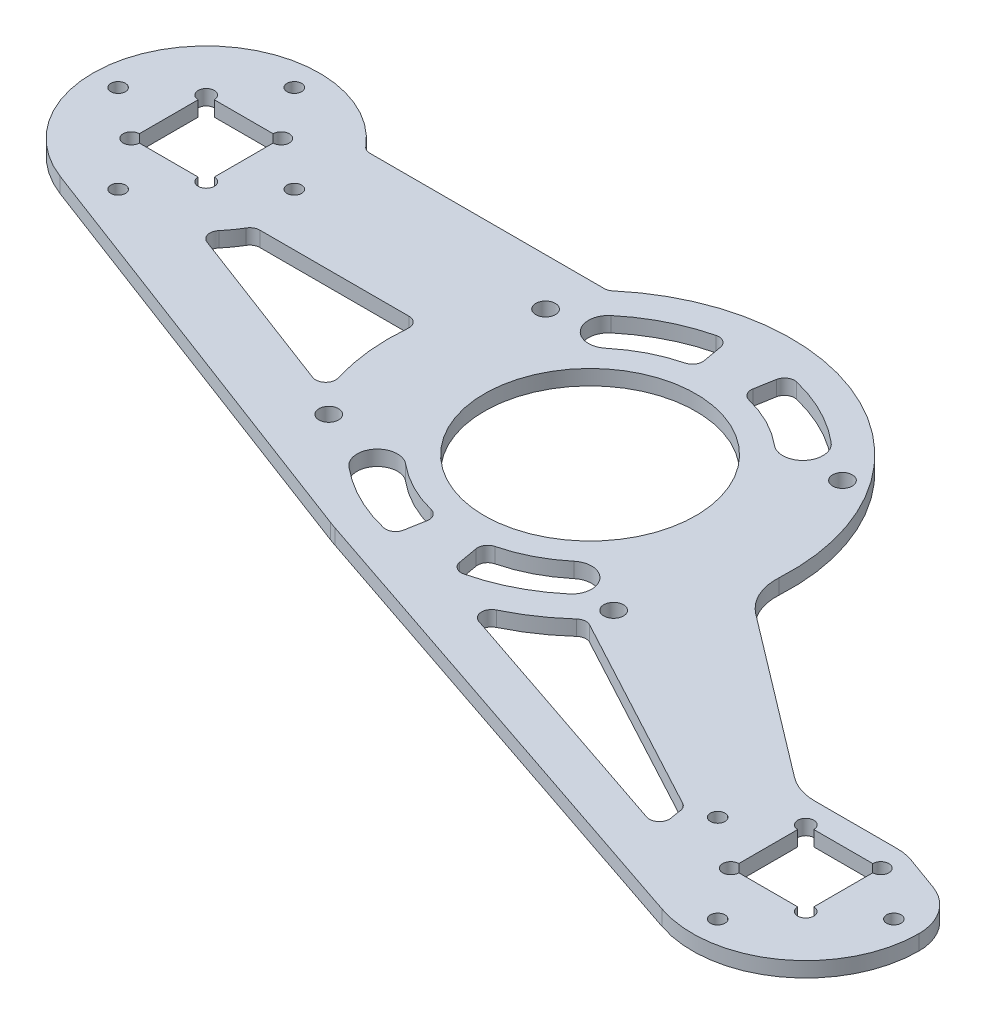
from build123d import *

# Parameters (mm, degrees)
SKETCH_1_W           = 206
SKETCH_1_H           = 60
SKETCH_1_R           = 21
EXTRUDE_1_DEPTH      = 3
SKETCH_2_W           = 14.9
SKETCH_2_H           = 14.9
CUT_EXTRUDE_1_DEPTH  = 108.321945566
SKETCH_3_W           = 80
SKETCH_3_H           = 35.85
CUT_EXTRUDE_2_DEPTH  = 108.321945566
SKETCH_4_R           = 22.5
SKETCH_4_W           = 14.9
SKETCH_4_H           = 14.9
EXTRUDE_2_DEPTH      = 3
EXTRUDE_START        = -3
SKETCH_5_R           = 40
SKETCH_5_R_2         = 21
EXTRUDE_3_DEPTH      = 3
SKETCH_6_R           = 1.6
CUT_EXTRUDE_3_DEPTH  = 122.842121206
SKETCH_7_R           = 1.45
CUT_EXTRUDE_4_DEPTH  = 122.842121206
SKETCH_8_R           = 5
EXTRUDE_4_DEPTH      = 3
SKETCH_9_R           = 1.95
CUT_EXTRUDE_5_DEPTH  = 122.842121206
SKETCH_10_R          = 1.95
CUT_EXTRUDE_6_DEPTH  = 122.842121206
EXTRUDE_5_DEPTH      = 3
FILLET_1_R           = 2
CUT_EXTRUDE_7_DEPTH  = 122.842121206
EXTRUDE_6_DEPTH      = 3
FILLET_2_R           = 2
SKETCH_14_R          = 22.5
SKETCH_14_R_2        = 1.45
SKETCH_14_W          = 14.9
SKETCH_14_H          = 14.9
EXTRUDE_7_DEPTH      = 3
CUT_EXTRUDE_8_DEPTH  = 136.861482768
EXTRUDE_8_DEPTH      = 3
CUT_EXTRUDE_9_DEPTH  = 136.861482768
EXTRUDE_9_DEPTH      = 3
EXTRUDE_10_DEPTH     = 3
FILLET_3_R           = 2
FILLET_4_R           = 10
SKETCH_21_R          = 1.6
CUT_EXTRUDE_10_DEPTH = 136.861482768


with BuildPart() as part:
    # 草图1 → 凸台-拉伸1 (new body)
    with BuildSketch(Plane(origin=(0, 0, 0), x_dir=(1, 0, 0), z_dir=(0, 1, 0))):
        Rectangle(SKETCH_1_W, SKETCH_1_H)
        with Locations(Location((0, 0, 0), (0, 0, 270))):
            Circle(SKETCH_1_R, mode=Mode.SUBTRACT)
    extrude(amount=EXTRUDE_1_DEPTH)

    # 草图2 → 切除-拉伸1 (cut, through all)
    with BuildSketch(Plane(origin=(0, 3, 0), x_dir=(1, 0, 0), z_dir=(0, 1, 0))):
        with Locations((-92.55, 16.3)):
            Rectangle(SKETCH_2_W, SKETCH_2_H)
        with Locations((92.55, 16.3)):
            Rectangle(SKETCH_2_W, SKETCH_2_H)
    extrude(amount=-CUT_EXTRUDE_1_DEPTH, mode=Mode.SUBTRACT)

    # 草图3 → 切除-拉伸2 (cut, through all)
    with BuildSketch(Plane(origin=(0, 3, 0), x_dir=(1, 0, 0), z_dir=(0, 1, 0))):
        with Locations((-63, -12.075)):
            Rectangle(SKETCH_3_W, SKETCH_3_H)
        with Locations((63, -12.075)):
            Rectangle(SKETCH_3_W, SKETCH_3_H)
    extrude(amount=-CUT_EXTRUDE_2_DEPTH, mode=Mode.SUBTRACT)

    # 草图4 → 凸台-拉伸2 (add)
    # profile 1 of 2: a face of its own
    with BuildSketch(Plane(origin=(0, 3, 0), x_dir=(1, 0, 0), z_dir=(0, 1, 0))):
        with Locations((-92.55, 16.3)):
            Circle(SKETCH_4_R)
        with Locations((-92.55, 16.3)):
            Rectangle(SKETCH_4_W, SKETCH_4_H, mode=Mode.SUBTRACT)
    # profile 2 of 2: a face of its own
    with BuildSketch(Plane(origin=(0, 3, 0), x_dir=(1, 0, 0), z_dir=(0, 1, 0))):
        with Locations((92.55, 16.3)):
            Circle(SKETCH_4_R)
        with Locations((92.55, 16.3)):
            Rectangle(SKETCH_4_W, SKETCH_4_H, mode=Mode.SUBTRACT)
    extrude(amount=-EXTRUDE_2_DEPTH)

    # 草图5 → 凸台-拉伸3 (add)
    with BuildSketch(Plane(origin=(0, 3, 0), x_dir=(1, 0, 0), z_dir=(0, 1, 0)).offset(EXTRUDE_START)):
        Circle(SKETCH_5_R)
        with Locations(Location((0, 0, 0), (0, 0, 270))):
            Circle(SKETCH_5_R_2, mode=Mode.SUBTRACT)
    extrude(amount=EXTRUDE_3_DEPTH)

    # 草图6 → 切除-拉伸3 (cut, through all)
    with BuildSketch(Plane(origin=(0, 3, 0), x_dir=(1, 0, 0), z_dir=(0, 1, 0))):
        with Locations((-100, 23.75)):
            Circle(SKETCH_6_R)
        with Locations((-85.1, 23.75)):
            Circle(SKETCH_6_R)
        with Locations((-100, 8.85)):
            Circle(SKETCH_6_R)
        with Locations((-85.1, 8.85)):
            Circle(SKETCH_6_R)
        with Locations((85.1, 8.85)):
            Circle(SKETCH_6_R)
        with Locations((100, 8.85)):
            Circle(SKETCH_6_R)
        with Locations((85.1, 23.75)):
            Circle(SKETCH_6_R)
        with Locations((100, 23.75)):
            Circle(SKETCH_6_R)
    extrude(amount=-CUT_EXTRUDE_3_DEPTH, mode=Mode.SUBTRACT)

    # 草图7 → 切除-拉伸4 (cut, through all)
    with BuildSketch(Plane(origin=(0, 3, 0), x_dir=(1, 0, 0), z_dir=(0, 1, 0))):
        with Locations(Location((-92.55, 33.8, 0), (0, 0, 270))):
            Circle(SKETCH_7_R)
        with Locations(Location((-75.05, 16.3, 0), (0, 0, 270))):
            Circle(SKETCH_7_R)
        with Locations(Location((-92.55, -1.2, 0), (0, 0, 270))):
            Circle(SKETCH_7_R)
        with Locations(Location((-110.05, 16.3, 0), (0, 0, 270))):
            Circle(SKETCH_7_R)
        with Locations(Location((110.05, 16.3, 0), (0, 0, 90))):
            Circle(SKETCH_7_R)
        with Locations(Location((92.55, -1.2, 0), (0, 0, 90))):
            Circle(SKETCH_7_R)
        with Locations(Location((75.05, 16.3, 0), (0, 0, 90))):
            Circle(SKETCH_7_R)
        with Locations(Location((92.55, 33.8, 0), (0, 0, 90))):
            Circle(SKETCH_7_R)
    extrude(amount=-CUT_EXTRUDE_4_DEPTH, mode=Mode.SUBTRACT)

    # 草图8 → 凸台-拉伸4 (add)
    with BuildSketch(Plane(origin=(0, 3, 0), x_dir=(1, 0, 0), z_dir=(0, 1, 0))):
        with Locations((-32.908965344, -19)):
            Circle(SKETCH_8_R)
        with Locations((29.109688839, -24.425929168)):
            Circle(SKETCH_8_R)
    extrude(amount=-EXTRUDE_4_DEPTH)

    # 草图9 → 切除-拉伸5 (cut, through all)
    with BuildSketch(Plane(origin=(0, 3, 0), x_dir=(1, 0, 0), z_dir=(0, 1, 0))):
        with Locations(Location((-32.908965344, -19, 0), (0, 0, 270))):
            Circle(SKETCH_9_R)
        with Locations(Location((29.109688839, -24.425929168, 0), (0, 0, 270))):
            Circle(SKETCH_9_R)
    extrude(amount=-CUT_EXTRUDE_5_DEPTH, mode=Mode.SUBTRACT)

    # 草图10 → 切除-拉伸6 (cut, through all)
    with BuildSketch(Plane(origin=(0, 3, 0), x_dir=(1, 0, 0), z_dir=(0, 1, 0))):
        with Locations(Location((29.489473594, 20.648751709, 0), (0, 0, 270))):
            Circle(SKETCH_10_R)
        with Locations(Location((-29.489473594, 20.648751709, 0), (0, 0, 270))):
            Circle(SKETCH_10_R)
    extrude(amount=-CUT_EXTRUDE_6_DEPTH, mode=Mode.SUBTRACT)

    # 草图11 → 凸台-拉伸5 (add)
    with BuildSketch(Plane(origin=(0, 3, 0), x_dir=(1, 0, 0), z_dir=(0, 1, 0)).offset(EXTRUDE_START)):
        with BuildLine():
            ThreePointArc((-77.465475941, -0.39452407), (-88.376578359, -5.809557929), (-100.510851903, -4.744591633))
            Line((-100.510851903, -4.744591633), (-14.152625605, -37.412607347))
            ThreePointArc((-14.152625605, -37.412607347), (-24.067697739, -31.949114628), (-32.05497123, -23.926529616))
            ThreePointArc((-32.05497123, -23.926529616), (-37.239092363, -21.5), (-36.748468086, -15.797154595))
            Line((-36.748468086, -15.797154595), (-77.465475941, -0.39452407))
        make_face()
        with BuildLine():
            ThreePointArc((27.413185924, -29.129319207), (21.191564067, -33.925176674), (14.152625605, -37.412607347))
            Line((14.152625605, -37.412607347), (100.510851903, -4.744591633))
            ThreePointArc((100.510851903, -4.744591633), (88.376578359, -5.809557929), (77.465475941, -0.39452407))
            Line((77.465475941, -0.39452407), (36.748468086, -15.797154595))
            ThreePointArc((36.748468086, -15.797154595), (35.231816329, -18.939881683), (33.447029175, -21.938464836))
            ThreePointArc((33.447029175, -21.938464836), (32.939911054, -27.639867217), (27.413185924, -29.129319207))
        make_face()
    extrude(amount=EXTRUDE_5_DEPTH)

    # 圆角1
    fillet_1_edges = [part.edges().sort_by_distance(p)[0] for p in [
        (-39.569906495, 1.5, -5.85),
        (26.457513111, 1.5, -30),
        (39.569906495, 1.5, -5.85),
        (-26.457513111, 1.5, -30),
        (-36.748468086, 1.5, 15.797154595),
        (-77.465475941, 1.5, 0.39452407),
        (77.465475941, 1.5, 0.39452407),
        (36.748468086, 1.5, 15.797154595),
        (-72.623949212, 1.5, -5.85),
        (72.623949212, 1.5, -5.85),
        (-74.701750786, 1.5, -30),
        (74.701750786, 1.5, -30),
    ]]
    fillet(fillet_1_edges, radius=FILLET_1_R)

    # 草图12 → 切除-拉伸7 (cut, through all)
    with BuildSketch(Plane(origin=(0, 3, 0), x_dir=(1, 0, 0), z_dir=(0, 1, 0))):
        with BuildLine():
            ThreePointArc((-21.854778729, -26.045511066), (0, -34), (21.854778729, -26.045511066))
            ThreePointArc((21.854778729, -26.045511066), (22.347806063, -20.410182855), (16.712477852, -19.917155521))
            ThreePointArc((16.712477852, -19.917155521), (0, -26), (-16.712477852, -19.917155521))
            ThreePointArc((-16.712477852, -19.917155521), (-22.347806063, -20.410182855), (-21.854778729, -26.045511066))
        make_face()
        with BuildLine():
            ThreePointArc((-21.854778729, 26.045511066), (0, 34), (21.854778729, 26.045511066))
            ThreePointArc((21.854778729, 26.045511066), (22.347806063, 20.410182855), (16.712477852, 19.917155521))
            ThreePointArc((16.712477852, 19.917155521), (0, 26), (-16.712477852, 19.917155521))
            ThreePointArc((-16.712477852, 19.917155521), (-22.347806063, 20.410182855), (-21.854778729, 26.045511066))
        make_face()
    extrude(amount=-CUT_EXTRUDE_7_DEPTH, mode=Mode.SUBTRACT)

    # 草图13 → 凸台-拉伸6 (add)
    with BuildSketch(Plane(origin=(0, 3, 0), x_dir=(1, 0, 0), z_dir=(0, 1, 0))):
        with BuildLine():
            ThreePointArc((4.514852619, -25.605001578), (0, -26), (-4.514852619, -25.605001578))
            Line((-4.514852619, -25.605001578), (-5.904038041, -33.483463602))
            ThreePointArc((-5.904038041, -33.483463602), (0, -34), (5.904038041, -33.483463602))
            Line((5.904038041, -33.483463602), (4.514852619, -25.605001578))
        make_face()
        with BuildLine():
            Line((-5.904038041, 33.483463602), (-4.514852619, 25.605001578))
            ThreePointArc((-4.514852619, 25.605001578), (0, 26), (4.514852619, 25.605001578))
            Line((4.514852619, 25.605001578), (5.904038041, 33.483463602))
            ThreePointArc((5.904038041, 33.483463602), (0, 34), (-5.904038041, 33.483463602))
        make_face()
    extrude(amount=-EXTRUDE_6_DEPTH)

    # 圆角2
    fillet_2_edges = [part.edges().sort_by_distance(p)[0] for p in [
        (-5.904038041, 1.5, 33.483463602),
        (-4.514852619, 1.5, 25.605001578),
        (4.514852619, 1.5, 25.605001578),
        (5.904038041, 1.5, 33.483463602),
        (5.904038041, 1.5, -33.483463602),
        (4.514852619, 1.5, -25.605001578),
        (-4.514852619, 1.5, -25.605001578),
        (-5.904038041, 1.5, -33.483463602),
    ]]
    fillet(fillet_2_edges, radius=FILLET_2_R)

    # 草图15 → 切除-拉伸8 (cut, through all)
    with BuildSketch(Plane(origin=(0, 3, 0), x_dir=(1, 0, 0), z_dir=(0, 1, 0))):
        with BuildLine():
            ThreePointArc((40, 0), (32.909763173, -22.736479233), (14.152625605, -37.412607347))
            Line((14.152625605, -37.412607347), (100.510851903, -4.744591633))
            ThreePointArc((100.510851903, -4.744591633), (110.882619843, 29.344732641), (75.276879754, 30.718367347))
            ThreePointArc((75.276879754, 30.718367347), (74.589056829, 30.188472288), (73.741491287, 30))
            Line((73.741491287, 30), (27.202941017, 30))
            ThreePointArc((27.202941017, 30), (26.512875458, 30.122818729), (25.907562874, 30.476190476))
            ThreePointArc((25.907562874, 30.476190476), (36.306352853, 16.788351394), (40, 0))
        make_face()
    extrude(amount=-CUT_EXTRUDE_8_DEPTH, mode=Mode.SUBTRACT)



with BuildPart() as body_2:
    # 草图14 → 凸台-拉伸7 (new body)
    with BuildSketch(Plane(origin=(0, 3, 0), x_dir=(1, 0, 0), z_dir=(0, 1, 0))):
        with Locations(Location((92.55, -49.7, 0), (0, 0, 270))):
            Circle(SKETCH_14_R)
        with Locations(Location((92.55, -32.2, 0), (0, 0, 270))):
            Circle(SKETCH_14_R_2, mode=Mode.SUBTRACT)
        with Locations(Location((110.05, -49.7, 0), (0, 0, 270))):
            Circle(SKETCH_14_R_2, mode=Mode.SUBTRACT)
        with Locations(Location((92.55, -67.2, 0), (0, 0, 270))):
            Circle(SKETCH_14_R_2, mode=Mode.SUBTRACT)
        with Locations(Location((75.05, -49.7, 0), (0, 0, 270))):
            Circle(SKETCH_14_R_2, mode=Mode.SUBTRACT)
        with Locations((92.55, -49.7)):
            Rectangle(SKETCH_14_W, SKETCH_14_H, mode=Mode.SUBTRACT)
    extrude(amount=-EXTRUDE_7_DEPTH)


with BuildPart() as part_1:
    add(part.part)

    add(body_2.part)  # 凸台-拉伸8 merges body 2
    # 草图16 → 凸台-拉伸8 (add)
    with BuildSketch(Plane(origin=(0, 3, 0), x_dir=(1, 0, 0), z_dir=(0, 1, 0)).offset(EXTRUDE_START)):
        with BuildLine():
            ThreePointArc((70.104667661, -51.26749998), (72.727377357, -39.055112422), (81.459214411, -30.123369161))
            Line((81.459214411, -30.123369161), (39.294298822, -7.480513356))
            ThreePointArc((39.294298822, -7.480513356), (35.240218032, -18.924244583), (27.939752072, -28.624644175))
            Line((27.939752072, -28.624644175), (70.104667661, -51.26749998))
        make_face()
    extrude(amount=EXTRUDE_8_DEPTH)

    # 草图17 → 切除-拉伸9 (cut, through all)
    with BuildSketch(Plane(origin=(0, 3, 0), x_dir=(1, 0, 0), z_dir=(0, 1, 0))):
        with BuildLine():
            Line((81.459214411, -30.123369161), (39.294298822, -7.480513356))
            Line((39.294298822, -7.480513356), (85.1, -42.25))
            Line((85.1, -42.25), (113.780814869, -42.25))
            ThreePointArc((113.780814869, -42.25), (100.453723321, -28.633886033), (81.459214411, -30.123369161))
        make_face()
    extrude(amount=-CUT_EXTRUDE_9_DEPTH, mode=Mode.SUBTRACT)

    # 草图18 → 凸台-拉伸9 (add)
    with BuildSketch(Plane(origin=(0, 3, 0), x_dir=(1, 0, 0), z_dir=(0, 1, 0))):
        Polygon((85.1, -42.25), (100, -42.25), (113.780814869, -42.25), (100, -37.25), (78.51294543, -37.25), align=None)
    extrude(amount=-EXTRUDE_9_DEPTH)

    # 草图20 → 凸台-拉伸10 (add)
    with BuildSketch(Plane(origin=(0, 3, 0), x_dir=(1, 0, 0), z_dir=(0, 1, 0)).offset(EXTRUDE_START)):
        with BuildLine():
            ThreePointArc((12.508786089, -37.993818847), (-0.147824015, -39.99972685), (-12.789262437, -37.900326731))
            Line((-12.789262437, -37.900326731), (85.356039879, -71.018933786))
            ThreePointArc((85.356039879, -71.018933786), (77.037919165, -65.998016694), (71.612345453, -57.93799867))
            Line((71.612345453, -57.93799867), (12.508786089, -37.993818847))
        make_face()
    extrude(amount=EXTRUDE_10_DEPTH)

    # 圆角3
    fillet_3_edges = [part_1.edges().sort_by_distance(p)[0] for p in [
        (12.508786089, 1.5, 37.993818847),
        (71.612345453, 1.5, 57.93799867),
        (27.939752072, 1.5, 28.624644175),
        (70.104667661, 1.5, 51.26749998),
    ]]
    fillet(fillet_3_edges, radius=FILLET_3_R)

    # 圆角4
    fillet_4_edges = [part_1.edges().sort_by_distance(p)[0] for p in [
        (113.780814869, 1.5, 42.25),
        (78.51294543, 1.5, 37.25),
        (100, 1.5, 37.25),
        (39.294298822, 1.5, 7.480513356),
    ]]
    fillet(fillet_4_edges, radius=FILLET_4_R)

    # 草图21 → 切除-拉伸10 (cut, through all)
    with BuildSketch(Plane(origin=(0, 3, 0), x_dir=(1, 0, 0), z_dir=(0, 1, 0))):
        with Locations((85.1, -42.25)):
            Circle(SKETCH_21_R)
        with Locations((100, -42.25)):
            Circle(SKETCH_21_R)
        with Locations((85.1, -57.15)):
            Circle(SKETCH_21_R)
        with Locations((100, -57.15)):
            Circle(SKETCH_21_R)
    extrude(amount=-CUT_EXTRUDE_10_DEPTH, mode=Mode.SUBTRACT)


solid = part_1.part
